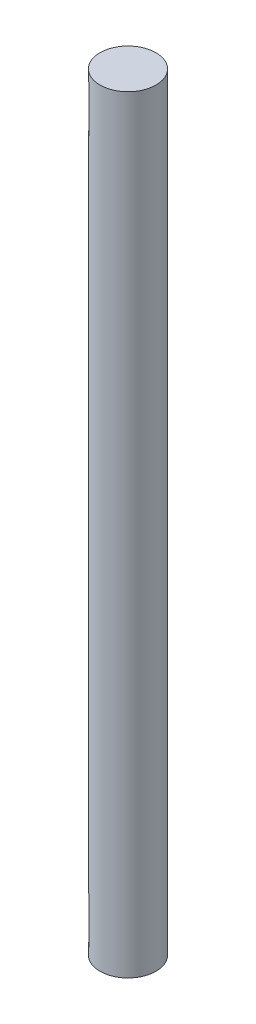
from build123d import *

# Parameters (mm, degrees)
SCHIZZO2_R                    = 2.485
ESTRUSIONE_ESTRUSIONE1_DEPTH  = 68.1
TAGLIO_ESTRUSIONE1_DEPTH      = 69.19061849
TAGLIO_ESTRUSIONE1_DEPTH_BACK = 69.19061849
SCHIZZO3_W                    = 1.05
SCHIZZO3_H                    = 4.16


with BuildPart() as part:
    # Schizzo2 → Estrusione-Estrusione1 (new body)
    with BuildSketch(Plane(origin=(0, 0, 0), x_dir=(1, 0, 0), z_dir=(0, 1, 0))):
        with Locations(Location((0, 0, 0), (0, 0, 270))):
            Circle(SCHIZZO2_R)
    extrude(amount=ESTRUSIONE_ESTRUSIONE1_DEPTH)

    # Schizzo3 → Taglio-Estrusione1 (cut, two sides: drawn at the far end of the back side and taken through both)
    with BuildSketch(Plane.XY.offset(-TAGLIO_ESTRUSIONE1_DEPTH_BACK)):
        with Locations((-1.96, 65.23)):
            Rectangle(SCHIZZO3_W, SCHIZZO3_H)
        with Locations((-1.96, 2.87)):
            Rectangle(SCHIZZO3_W, SCHIZZO3_H)
    extrude(amount=TAGLIO_ESTRUSIONE1_DEPTH + TAGLIO_ESTRUSIONE1_DEPTH_BACK, mode=Mode.SUBTRACT)


solid = part.part
